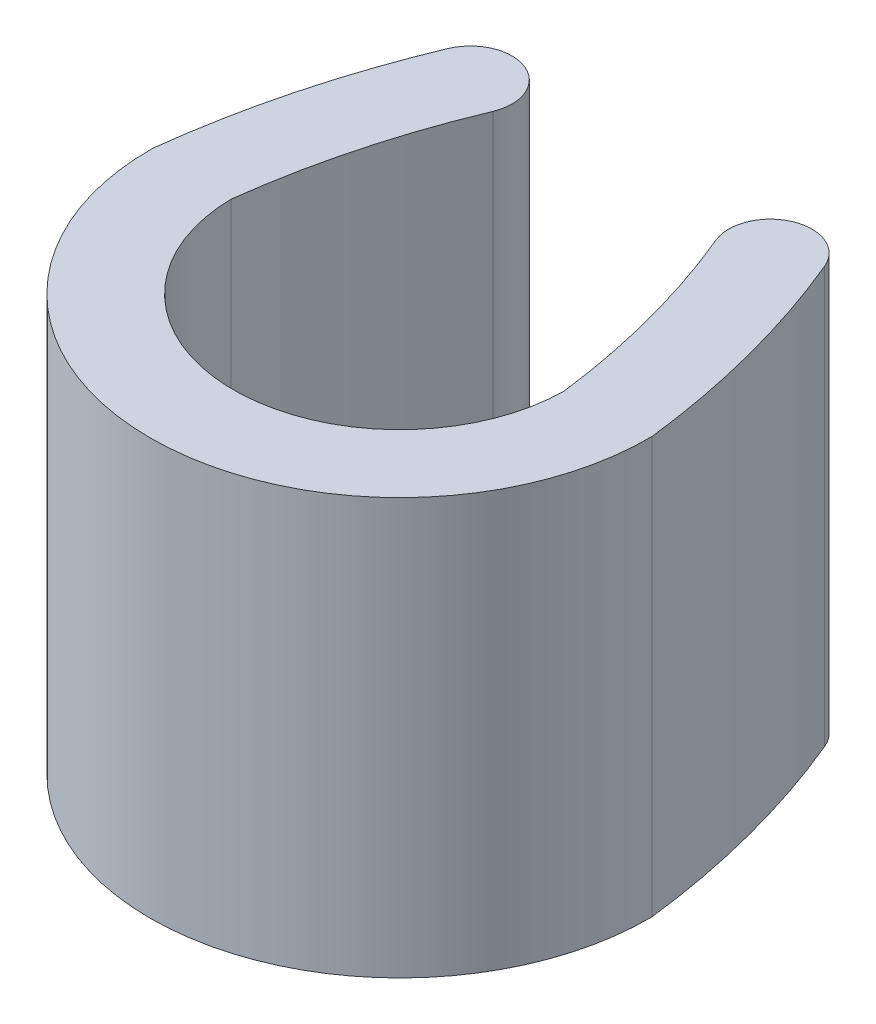
from build123d import *

# Parameters (mm, degrees)
BOSS_EXTRUDE1_DEPTH = 5


with BuildPart() as part:
    # Sketch1 → Boss-Extrude1 (new body)
    with BuildSketch(Plane(origin=(0, 0, 0), x_dir=(1, 0, 0), z_dir=(0, 1, 0))):
        with BuildLine():
            ThreePointArc((1.340495377, 2.4580665), (1.754717381, 1.237074536), (1.999793193, -0.028760798))
            ThreePointArc((1.999793193, -0.028760798), (0, -2), (-1.999793193, -0.028760798))
            ThreePointArc((-1.999793193, -0.028760798), (-1.754717381, 1.237074536), (-1.340495377, 2.4580665))
            ThreePointArc((-1.340495377, 2.4580665), (-1.609603502, 3.111963141), (-2.263500143, 2.842855016))
            ThreePointArc((-2.263500143, 2.842855016), (-2.729436806, 1.462550003), (-2.999839417, 0.031039846))
            ThreePointArc((-2.999839417, 0.031039846), (0, -3), (2.999839417, 0.031039846))
            ThreePointArc((2.999839417, 0.031039846), (2.729436806, 1.462550003), (2.263500143, 2.842855016))
            ThreePointArc((2.263500143, 2.842855016), (1.609603502, 3.111963141), (1.340495377, 2.4580665))
        make_face()
    extrude(amount=BOSS_EXTRUDE1_DEPTH)


solid = part.part
